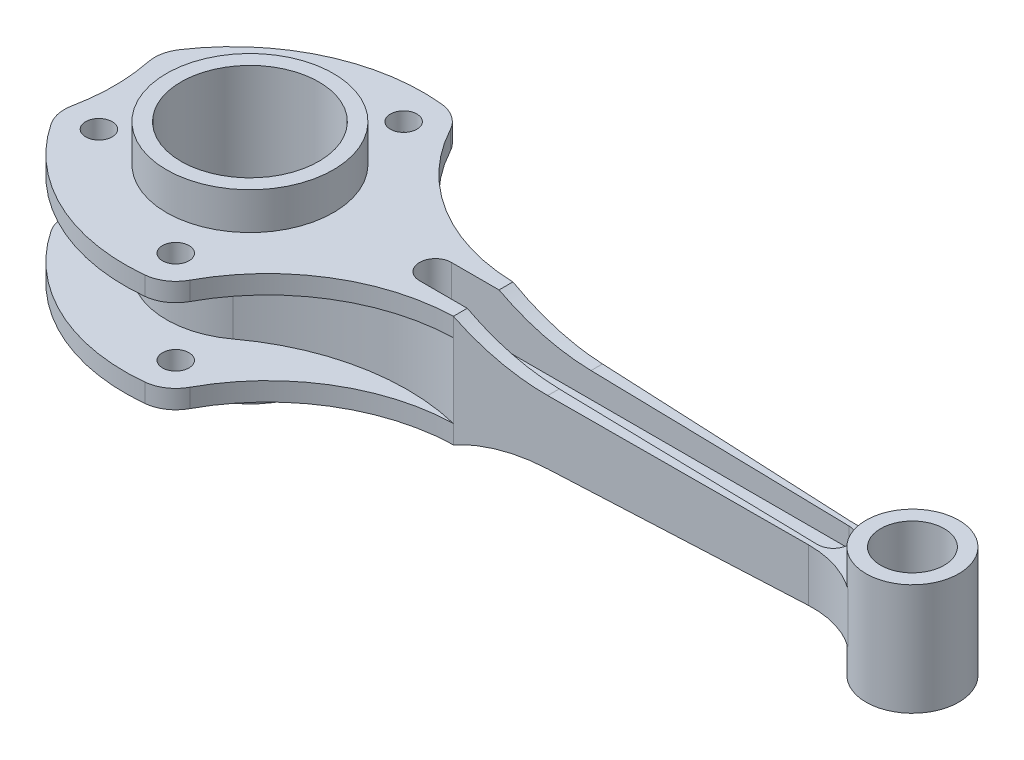
from build123d import *

# Parameters (mm, degrees)
SKETCH1_R               = 12
BOSS_EXTRUDE1_DEPTH     = 21
SKETCH1_3_R             = 26
BOSS_EXTRUDE2_DEPTH     = 35
SKETCH1_4_R             = 31.5
SKETCH1_4_R_2           = 5
BOSS_EXTRUDE3_DEPTH     = 21
BOSS_EXTRUDE4_DEPTH     = 2.5
CUT_EXTRUDE1_DEPTH      = 311.166315701
CUT_EXTRUDE1_DEPTH_BACK = 311.166315701
SKETCH1_6_R             = 12
BOSS_EXTRUDE5_DEPTH     = 21
SKETCH1_7_R             = 5
CUT_EXTRUDE2_DEPTH      = 14


with BuildPart() as part:
    # Sketch1 → Boss-Extrude1 (new, symmetric)
    with BuildSketch(Plane(origin=(0, 0, 0), x_dir=(1, 0, 0), z_dir=(0, 1, 0))):
        with BuildLine():
            ThreePointArc((17.5, 0), (8.02934676, 15.549263346), (-10.131953212, 14.268620259))
            ThreePointArc((-10.131953212, 14.268620259), (-17.5, 0), (-10.131953212, -14.268620259))
            ThreePointArc((-10.131953212, -14.268620259), (8.02934676, -15.549263346), (17.5, 0))
        make_face()
        Circle(SKETCH1_R, mode=Mode.SUBTRACT)
    extrude(amount=BOSS_EXTRUDE1_DEPTH, both=True)



with BuildPart() as body_2:
    # Sketch1<3> → Boss-Extrude2 (new, symmetric)
    with BuildSketch(Plane(origin=(0, 0, 0), x_dir=(1, 0, 0), z_dir=(0, 1, 0))):
        with BuildLine():
            ThreePointArc((-218.5, 0), (-221.853950514, 14.143899687), (-231.201580847, 25.275866699))
            ThreePointArc((-231.201580847, 25.275866699), (-281.5, 0), (-231.201580847, -25.275866699))
            ThreePointArc((-231.201580847, -25.275866699), (-221.853950514, -14.143899687), (-218.5, 0))
        make_face()
        with Locations((-250, 0)):
            Circle(SKETCH1_3_R, mode=Mode.SUBTRACT)
    extrude(amount=BOSS_EXTRUDE2_DEPTH, both=True)


with BuildPart() as part_1:
    add(part.part)

    add(body_2.part)  # Boss-Extrude3 merges body 2
    # Sketch1<4> → Boss-Extrude3 (add, symmetric)
    with BuildSketch(Plane(origin=(0, 0, 0), x_dir=(1, 0, 0), z_dir=(0, 1, 0))):
        with BuildLine():
            ThreePointArc((-10.131953212, 14.268620259), (-20.198477773, 9.324322534), (-31.312052828, 7.817854403))
            Line((-31.312052828, 7.817854403), (-162, 11.240038738))
            ThreePointArc((-162, 11.240038738), (-197.875878659, 21.911731191), (-223.547039722, 49.150585409))
            ThreePointArc((-223.547039722, 49.150585409), (-227.777941589, 53.8093419), (-233.701306889, 55.934967963))
            ThreePointArc((-233.701306889, 55.934967963), (-271.66540115, 49.388348587), (-300.819950957, 24.206154404))
            ThreePointArc((-300.819950957, 24.206154404), (-302.758398561, 19.494647504), (-302.737346662, 14.4))
            ThreePointArc((-302.737346662, 14.4), (-301.282651255, 0), (-302.737346662, -14.4))
            ThreePointArc((-302.737346662, -14.4), (-302.758398561, -19.494647504), (-300.819950957, -24.206154404))
            ThreePointArc((-300.819950957, -24.206154404), (-271.66540115, -49.388348587), (-233.701306889, -55.934967963))
            ThreePointArc((-233.701306889, -55.934967963), (-227.777941589, -53.8093419), (-223.547039722, -49.150585409))
            ThreePointArc((-223.547039722, -49.150585409), (-197.875878659, -21.911731191), (-162, -11.240038738))
            Line((-162, -11.240038738), (-31.312052828, -7.817854403))
            ThreePointArc((-31.312052828, -7.817854403), (-20.198477773, -9.324322534), (-10.131953212, -14.268620259))
            ThreePointArc((-10.131953212, -14.268620259), (-17.5, 0), (-10.131953212, 14.268620259))
        make_face()
        with Locations((-250, 0)):
            Circle(SKETCH1_4_R, mode=Mode.SUBTRACT)
        with BuildLine():
            ThreePointArc((-180, -6), (-186, 0), (-180, 6))
            Line((-180, 6), (-30, 6))
            ThreePointArc((-30, 6), (-24, 0), (-30, -6))
            Line((-30, -6), (-180, -6))
        make_face(mode=Mode.SUBTRACT)
        with Locations((-290, 17)):
            Circle(SKETCH1_4_R_2, mode=Mode.SUBTRACT)
        with Locations((-235, 43)):
            Circle(SKETCH1_4_R_2, mode=Mode.SUBTRACT)
        with Locations((-235, -43)):
            Circle(SKETCH1_4_R_2, mode=Mode.SUBTRACT)
        with Locations((-290, -17)):
            Circle(SKETCH1_4_R_2, mode=Mode.SUBTRACT)
    extrude(amount=BOSS_EXTRUDE3_DEPTH, both=True)

    # Sketch1<5> → Boss-Extrude4 (add, symmetric)
    with BuildSketch(Plane(origin=(0, 0, 0), x_dir=(1, 0, 0), z_dir=(0, 1, 0))):
        with BuildLine():
            Line((-30, 6), (-180, 6))
            ThreePointArc((-180, 6), (-186, 0), (-180, -6))
            Line((-180, -6), (-30, -6))
            ThreePointArc((-30, -6), (-24, 0), (-30, 6))
        make_face()
    extrude(amount=BOSS_EXTRUDE4_DEPTH, both=True)

    # Sketch3 → Cut-Extrude1 (cut, two sides: drawn at the far end of the back side and taken through both)
    with BuildSketch(Plane.XY.offset(-CUT_EXTRUDE1_DEPTH_BACK)):
        with BuildLine():
            ThreePointArc((-162, 21), (-145.170802033, 14.478720031), (-127.293303783, 12))
            Line((-127.293303783, 12), (17.5, 8.840598872))
            Line((17.5, 8.840598872), (17.5, 21))
            Line((17.5, 21), (-162, 21))
        make_face()
        with BuildLine():
            Line((17.5, -8.840598872), (-127.293303783, -12))
            ThreePointArc((-127.293303783, -12), (-145.170802033, -14.478720031), (-162, -21))
            Line((-162, -21), (17.5, -21))
            Line((17.5, -21), (17.5, -8.840598872))
        make_face()
    extrude(amount=CUT_EXTRUDE1_DEPTH + CUT_EXTRUDE1_DEPTH_BACK, mode=Mode.SUBTRACT)

    # Sketch1<6> → Boss-Extrude5 (add, symmetric)
    with BuildSketch(Plane(origin=(0, 0, 0), x_dir=(1, 0, 0), z_dir=(0, 1, 0))):
        with BuildLine():
            ThreePointArc((17.5, 0), (8.02934676, 15.549263346), (-10.131953212, 14.268620259))
            ThreePointArc((-10.131953212, 14.268620259), (-17.5, 0), (-10.131953212, -14.268620259))
            ThreePointArc((-10.131953212, -14.268620259), (8.02934676, -15.549263346), (17.5, 0))
        make_face()
        Circle(SKETCH1_6_R, mode=Mode.SUBTRACT)
    extrude(amount=BOSS_EXTRUDE5_DEPTH, both=True)

    # Sketch1<7> → Cut-Extrude2 (cut, symmetric)
    with BuildSketch(Plane(origin=(0, 0, 0), x_dir=(1, 0, 0), z_dir=(0, 1, 0))):
        with BuildLine():
            ThreePointArc((-231.201580847, 25.275866699), (-198.167794768, 10.53206878), (-162, 11.240038738))
            ThreePointArc((-162, 11.240038738), (-197.875878659, 21.911731191), (-223.547039722, 49.150585409))
            ThreePointArc((-223.547039722, 49.150585409), (-227.777941589, 53.8093419), (-233.701306889, 55.934967963))
            ThreePointArc((-233.701306889, 55.934967963), (-271.66540115, 49.388348587), (-300.819950957, 24.206154404))
            ThreePointArc((-300.819950957, 24.206154404), (-302.758398561, 19.494647504), (-302.737346662, 14.4))
            ThreePointArc((-302.737346662, 14.4), (-301.282651255, 0), (-302.737346662, -14.4))
            ThreePointArc((-302.737346662, -14.4), (-302.758398561, -19.494647504), (-300.819950957, -24.206154404))
            ThreePointArc((-300.819950957, -24.206154404), (-271.66540115, -49.388348587), (-233.701306889, -55.934967963))
            ThreePointArc((-233.701306889, -55.934967963), (-227.777941589, -53.8093419), (-223.547039722, -49.150585409))
            ThreePointArc((-223.547039722, -49.150585409), (-197.875878659, -21.911731191), (-162, -11.240038738))
            ThreePointArc((-162, -11.240038738), (-198.167794768, -10.53206878), (-231.201580847, -25.275866699))
            ThreePointArc((-231.201580847, -25.275866699), (-281.5, 0), (-231.201580847, 25.275866699))
        make_face()
        with Locations((-235, -43)):
            Circle(SKETCH1_7_R, mode=Mode.SUBTRACT)
        with Locations((-290, -17)):
            Circle(SKETCH1_7_R, mode=Mode.SUBTRACT)
        with Locations((-290, 17)):
            Circle(SKETCH1_7_R, mode=Mode.SUBTRACT)
        with Locations((-235, 43)):
            Circle(SKETCH1_7_R, mode=Mode.SUBTRACT)
    extrude(amount=CUT_EXTRUDE2_DEPTH, both=True, mode=Mode.SUBTRACT)


solid = part_1.part
